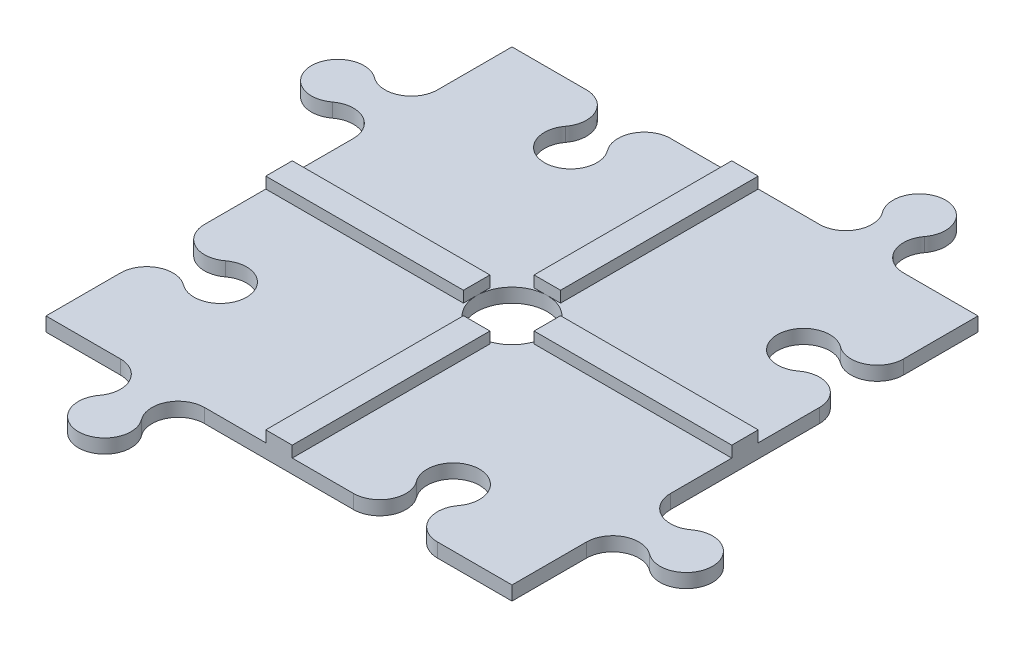
from build123d import *

# Parameters (mm, degrees)
SKETCH1_W           = 105.585817276
SKETCH1_H           = 105.585817276
BOSS_EXTRUDE1_DEPTH = 3.175
BOSS_EXTRUDE2_DEPTH = 3.175
CUT_EXTRUDE2_DEPTH  = 90.210847709
CIRPATTERN1_COUNT   = 4
SKETCH4_R           = 8.001
CUT_EXTRUDE3_DEPTH  = 3.175
SKETCH5_W           = 44.791908638
SKETCH5_H           = 3
BOSS_EXTRUDE3_DEPTH = 2.54
CIRPATTERN2_COUNT   = 4


with BuildPart() as part:
    # Sketch1 → Boss-Extrude1 (new body)
    with BuildSketch(Plane(origin=(0, 0, 0), x_dir=(1, 0, 0), z_dir=(0, 1, 0))):
        Rectangle(SKETCH1_W, SKETCH1_H)
    extrude(amount=BOSS_EXTRUDE1_DEPTH)

    # Sketch2 → Boss-Extrude2 (add)
    with BuildSketch(Plane(origin=(0, 0, 0), x_dir=(1, 0, 0), z_dir=(0, 1, 0))):
        with BuildLine():
            Line((-52.792908638, 35.921454319), (-52.792908638, 16.871454319))
            ThreePointArc((-52.792908638, 16.871454319), (-56.083715202, 22.19609119), (-62.317908638, 21.633954319))
            ThreePointArc((-62.317908638, 21.633954319), (-68.552102074, 21.071817448), (-71.842908638, 26.396454319))
            ThreePointArc((-71.842908638, 26.396454319), (-68.552102074, 31.72109119), (-62.317908638, 31.158954319))
            ThreePointArc((-62.317908638, 31.158954319), (-56.083715202, 30.596817448), (-52.792908638, 35.921454319))
        make_face()
    boss_extrude2 = extrude(amount=BOSS_EXTRUDE2_DEPTH)

    # Sketch2<3> → Cut-Extrude2 (cut, through all)
    with BuildSketch(Plane(origin=(0, 0, 0), x_dir=(1, 0, 0), z_dir=(0, 1, 0))):
        with BuildLine():
            Line((-52.792908638, -35.921454319), (-52.792908638, -16.871454319))
            ThreePointArc((-52.792908638, -16.871454319), (-49.502102074, -22.19609119), (-43.267908638, -21.633954319))
            ThreePointArc((-43.267908638, -21.633954319), (-37.033715202, -21.071817448), (-33.742908638, -26.396454319))
            ThreePointArc((-33.742908638, -26.396454319), (-37.033715202, -31.72109119), (-43.267908638, -31.158954319))
            ThreePointArc((-43.267908638, -31.158954319), (-49.502102074, -30.596817448), (-52.792908638, -35.921454319))
        make_face()
    cut_extrude2 = extrude(amount=CUT_EXTRUDE2_DEPTH, mode=Mode.SUBTRACT)

    # CirPattern1: Boss-Extrude2, Cut-Extrude2 ×4 about axis
    cirpattern1_axis = Axis((0, 0, 0), (0, 1, 0))
    add([boss_extrude2.rotate(cirpattern1_axis, i * 360 / CIRPATTERN1_COUNT) for i in range(1, CIRPATTERN1_COUNT)])
    add([cut_extrude2.rotate(cirpattern1_axis, i * 360 / CIRPATTERN1_COUNT) for i in range(1, CIRPATTERN1_COUNT)], mode=Mode.SUBTRACT)

    # Sketch4 → Cut-Extrude3 (cut)
    with BuildSketch(Plane(origin=(0, 3.175, 0), x_dir=(1, 0, 0), z_dir=(0, 1, 0))):
        with Locations(Location((0, 0, 0), (0, 0, 270))):
            Circle(SKETCH4_R)
    extrude(amount=-CUT_EXTRUDE3_DEPTH, mode=Mode.SUBTRACT)

    # Sketch5 → Boss-Extrude3 (add)
    with BuildSketch(Plane(origin=(0, 3.175, 0), x_dir=(1, 0, 0), z_dir=(0, 1, 0))):
        with Locations((-30.396954319, -1.5)):
            Rectangle(SKETCH5_W, SKETCH5_H)
        with Locations((-30.396954319, 1.5)):
            Rectangle(SKETCH5_W, SKETCH5_H)
    boss_extrude3 = extrude(amount=BOSS_EXTRUDE3_DEPTH)

    # CirPattern2: Boss-Extrude3 ×4 about axis
    cirpattern2_axis = Axis((0, 0, 0), (0, 1, 0))
    for i in range(1, CIRPATTERN2_COUNT):
        add(boss_extrude3.rotate(cirpattern2_axis, i * 360 / CIRPATTERN2_COUNT))


solid = part.part
